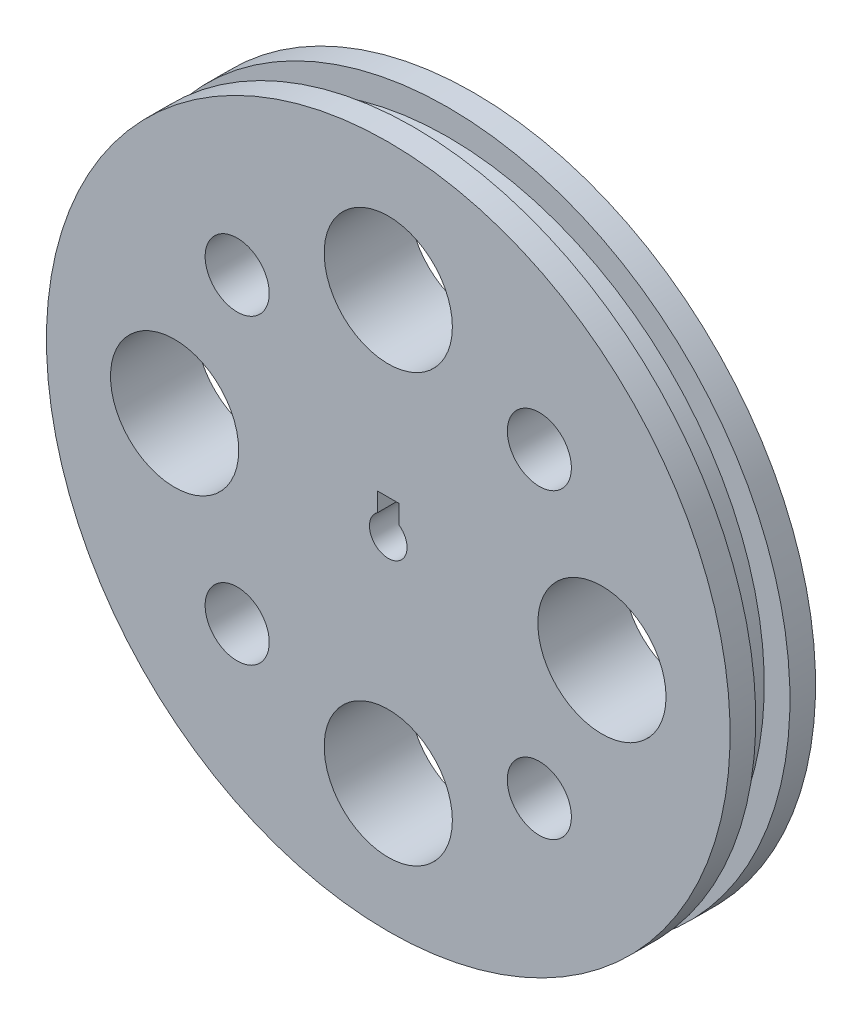
from build123d import *

# Parameters (mm, degrees)
CUT_EXTRUDE1_DEPTH      = 145.244271983
CUT_EXTRUDE1_DEPTH_BACK = 145.244271983
SKETCH5_R               = 19.05
SKETCH5_R_2             = 9.525
CUT_EXTRUDE5_DEPTH      = 145.244271983
CUT_EXTRUDE5_DEPTH_BACK = 145.244271983
SKETCH6_R               = 5.588
CUT_EXTRUDE6_DEPTH      = 145.244271983
CUT_EXTRUDE6_DEPTH_BACK = 145.244271983
SKETCH8_W               = 6.35
SKETCH8_H               = 5.561617784


with BuildPart() as part:
    # Sketch1 → Revolve2 (revolve)
    with BuildSketch(Plane(origin=(0, 0, 0), x_dir=(0, 0, -1), z_dir=(1, 0, 0))):
        Polygon((0, 0), (-12.7, 0), (-12.7, 101.6), (-5.08, 101.6), (-5.08, 93.98), (5.08, 93.98), (5.08, 101.6), (12.7, 101.6), (12.7, 0), align=None)
    revolve(axis=Axis((0, 0, 0), (0, 0, 1)))

    # Sketch5 → Cut-Extrude1 (cut, two sides: drawn at the far end of the back side and taken through both)
    with BuildSketch(Plane.XY.offset(-CUT_EXTRUDE1_DEPTH_BACK)):
        with Locations((0, -63.5)):
            Circle(SKETCH5_R)
        with Locations((44.901280605, -44.901280605)):
            Circle(SKETCH5_R_2)
        with Locations((-63.5, 0)):
            Circle(SKETCH5_R)
        with Locations((-44.901280605, -44.901280605)):
            Circle(SKETCH5_R_2)
        with Locations((0, 63.5)):
            Circle(SKETCH5_R)
        with Locations((-44.901280605, 44.901280605)):
            Circle(SKETCH5_R_2)
        with Locations((63.5, 0)):
            Circle(SKETCH5_R)
        with Locations((44.901280605, 44.901280605)):
            Circle(SKETCH5_R_2)
    extrude(amount=CUT_EXTRUDE1_DEPTH + CUT_EXTRUDE1_DEPTH_BACK, mode=Mode.SUBTRACT)

    # Sketch6 → Cut-Extrude5 (cut, two sides: drawn at the far end of the back side and taken through both)
    with BuildSketch(Plane.XY.offset(-CUT_EXTRUDE5_DEPTH_BACK)):
        Circle(SKETCH6_R)
    extrude(amount=CUT_EXTRUDE5_DEPTH + CUT_EXTRUDE5_DEPTH_BACK, mode=Mode.SUBTRACT)

    # Sketch8 → Cut-Extrude6 (cut, two sides: drawn at the far end of the back side and taken through both)
    with BuildSketch(Plane.XY.offset(-CUT_EXTRUDE6_DEPTH_BACK)):
        with Locations((0, 7.379191108)):
            Rectangle(SKETCH8_W, SKETCH8_H)
    extrude(amount=CUT_EXTRUDE6_DEPTH + CUT_EXTRUDE6_DEPTH_BACK, mode=Mode.SUBTRACT)


solid = part.part
